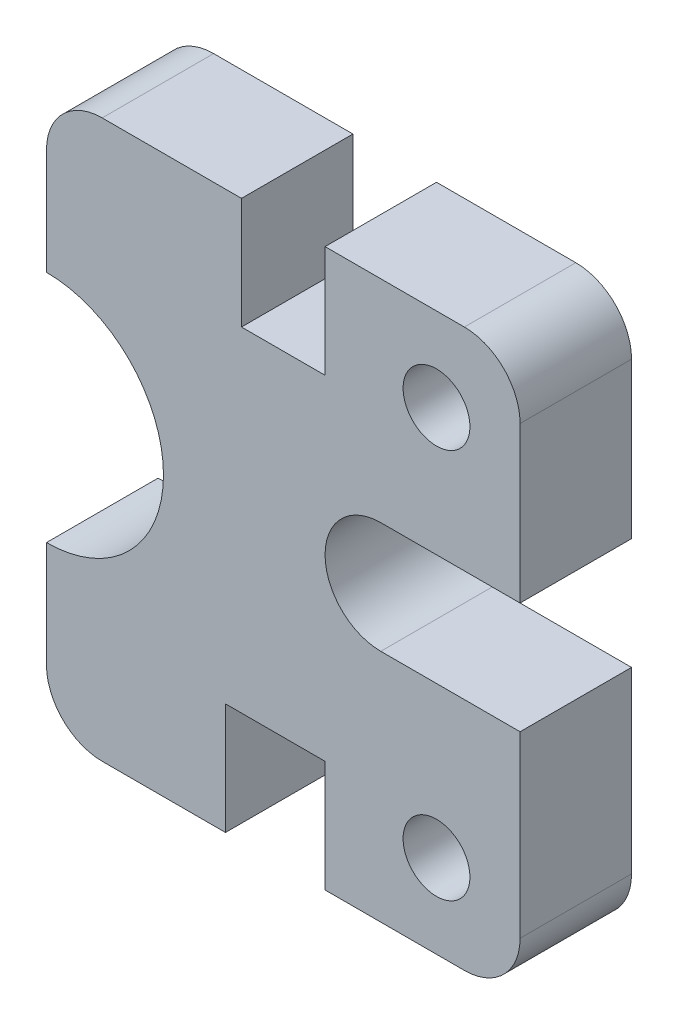
from build123d import *

# Parameters (mm, degrees)
SKETCH1_R           = 6
BOSS_EXTRUDE1_DEPTH = 20


with BuildPart() as part:
    # Sketch1 → Boss-Extrude1 (new body)
    with BuildSketch(Plane.XY):
        with BuildLine():
            Line((-7.5, 50), (-7.5, 30))
            Line((-7.5, 30), (7.5, 30))
            Line((7.5, 30), (7.5, 50))
            Line((7.5, 50), (32.5, 50))
            ThreePointArc((32.5, 50), (39.571067812, 47.071067812), (42.5, 40))
            Line((42.5, 40), (42.5, 12.097843739))
            Line((42.5, 12.097843739), (17.5, 12.097843739))
            ThreePointArc((17.5, 12.097843739), (7.5, 2.097843739), (17.5, -7.902156261))
            Line((17.5, -7.902156261), (42.5, -7.902156261))
            Line((42.5, -7.902156261), (42.5, -40))
            ThreePointArc((42.5, -40), (39.571067812, -47.071067812), (32.5, -50))
            Line((32.5, -50), (7.5, -50))
            Line((7.5, -50), (7.5, -30))
            Line((7.5, -30), (-10.372609166, -30))
            Line((-10.372609166, -30), (-10.372609166, -50))
            Line((-10.372609166, -50), (-32.5, -50))
            ThreePointArc((-32.5, -50), (-39.571067812, -47.071067812), (-42.5, -40))
            Line((-42.5, -40), (-42.5, -21))
            ThreePointArc((-42.5, -21), (-21.5, 0), (-42.5, 21))
            Line((-42.5, 21), (-42.5, 40))
            ThreePointArc((-42.5, 40), (-39.571067812, 47.071067812), (-32.5, 50))
            Line((-32.5, 50), (-7.5, 50))
        make_face()
        with Locations((27.5, 35)):
            Circle(SKETCH1_R, mode=Mode.SUBTRACT)
        with Locations((27.5, -35)):
            Circle(SKETCH1_R, mode=Mode.SUBTRACT)
    extrude(amount=BOSS_EXTRUDE1_DEPTH)


solid = part.part
